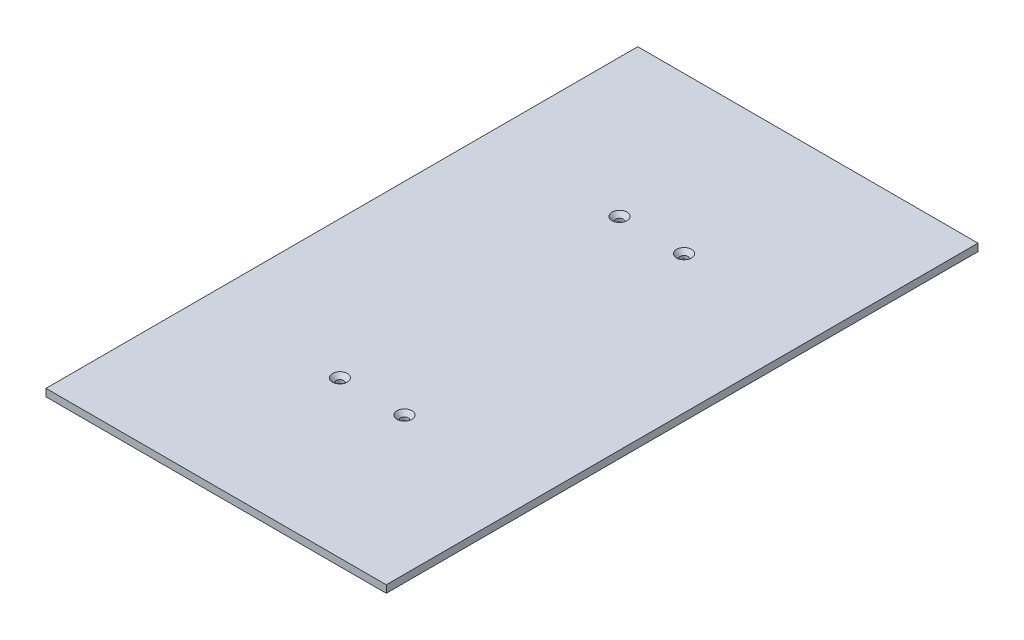
from build123d import *

# Parameters (mm, degrees)
SKETCH1_W                                     = 292.1
SKETCH1_H                                     = 508
BOSS_EXTRUDE1_DEPTH                           = 6.35
CSK_FOR_1_4_FLAT_HEAD_MACHINE_SCREW1_AT_COUNT = 2
CSK_FOR_1_4_FLAT_HEAD_MACHINE_SCREW1_AT_PITCH = 55.4
CSK_FOR_1_4_FLAT_HEAD_MACHINE_SCREW1_2_COUNT  = 2
CSK_FOR_1_4_FLAT_HEAD_MACHINE_SCREW1_2_PITCH  = 246.311104094
CSK_FOR_1_4_FLAT_HEAD_MACHINE_SCREW1_3_COUNT  = 2
CSK_FOR_1_4_FLAT_HEAD_MACHINE_SCREW1_3_PITCH  = 240


with BuildPart() as part:
    # Sketch1 → Boss-Extrude1 (new body)
    with BuildSketch(Plane(origin=(0, 0, 0), x_dir=(1, 0, 0), z_dir=(0, 1, 0))):
        with Locations((146.977170591, 231.004856512)):
            Rectangle(SKETCH1_W, SKETCH1_H)
    extrude(amount=BOSS_EXTRUDE1_DEPTH)

    # Sketch6 → CSK for 1/4 Flat Head Machine Screw1 (revolve, cut)
    with BuildSketch(Plane(origin=(119.277170591, 6.35, -351.004856512), x_dir=(0, 0, 1), z_dir=(1, 0, 0))):
        Polygon((0, 0), (0, 6.35), (3.2639, 6.35), (3.2639, 3.652419693), (6.4389, 0), align=None)
    csk_for_1_4_flat_head_machine_screw1 = revolve(axis=Axis((119.277170591, 12.7, -351.004856512), (0, -1, 0)), mode=Mode.SUBTRACT)

    # CSK for 1/4 Flat Head Machine Screw1 at: CSK for 1/4 Flat Head Machine Screw1 ×2
    with Locations(*[(i * CSK_FOR_1_4_FLAT_HEAD_MACHINE_SCREW1_AT_PITCH, 0, 0) for i in range(1, CSK_FOR_1_4_FLAT_HEAD_MACHINE_SCREW1_AT_COUNT)]):
        add(csk_for_1_4_flat_head_machine_screw1, mode=Mode.SUBTRACT)

    # CSK for 1_4 Flat Head Machine Screw1 2: CSK for 1/4 Flat Head Machine Screw1 ×2
    with Locations(*[Vector(0.22491880828425845, 0, 0.9743775088126722) * (i * CSK_FOR_1_4_FLAT_HEAD_MACHINE_SCREW1_2_PITCH) for i in range(1, CSK_FOR_1_4_FLAT_HEAD_MACHINE_SCREW1_2_COUNT)]):
        add(csk_for_1_4_flat_head_machine_screw1, mode=Mode.SUBTRACT)

    # CSK for 1_4 Flat Head Machine Screw1 3: CSK for 1/4 Flat Head Machine Screw1 ×2
    with Locations(*[(0, 0, i * CSK_FOR_1_4_FLAT_HEAD_MACHINE_SCREW1_3_PITCH) for i in range(1, CSK_FOR_1_4_FLAT_HEAD_MACHINE_SCREW1_3_COUNT)]):
        add(csk_for_1_4_flat_head_machine_screw1, mode=Mode.SUBTRACT)


solid = part.part
